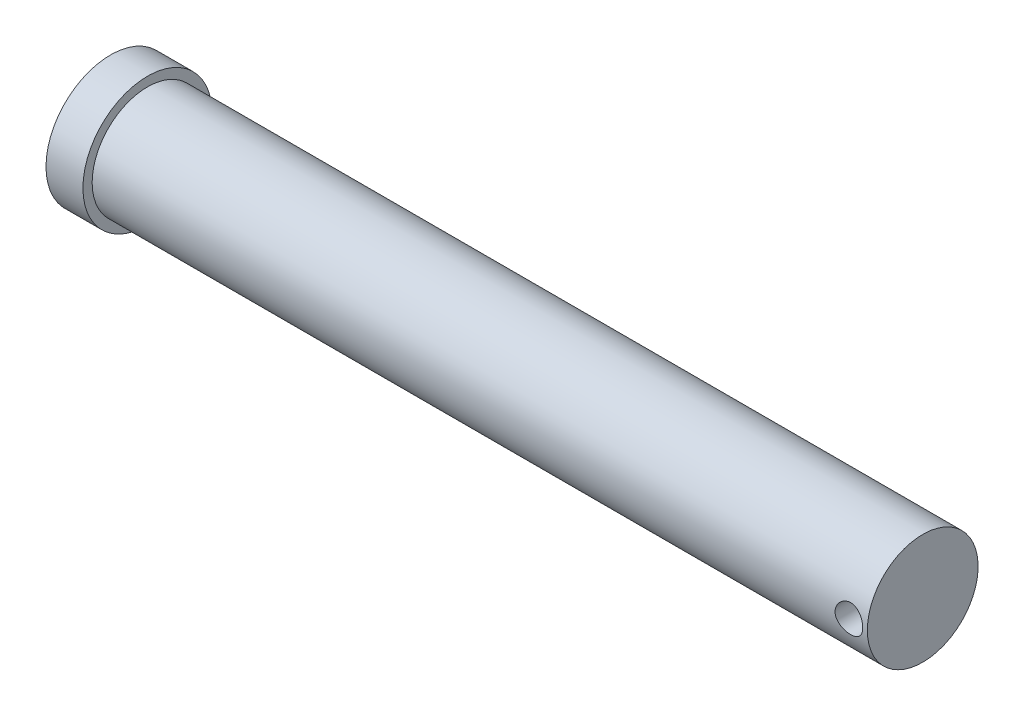
from build123d import *

# Parameters (mm, degrees)
IZIM2_R               = 7.5
KES_EKSTR_ZYON1_DEPTH = 30


with BuildPart() as part:
    # Çizim1 → Döndür1 (revolve)
    with BuildSketch(Plane.XY, mode=Mode.PRIVATE) as d_nd_r1_sk:
        Polygon((0, 0), (0, 35), (20, 35), (20, 30), (440, 30), (440, 0), align=None)
    revolve(d_nd_r1_sk.sketch.rotate(Axis((0, 0, 0), (1, 0, 0)), 90), axis=Axis((0, 0, 0), (1, 0, 0)))

    # Çizim2 → Kes-Ekstrüzyon1 (cut, symmetric)
    with BuildSketch(Plane.XY):
        with Locations((430, 0)):
            Circle(IZIM2_R)
    extrude(amount=KES_EKSTR_ZYON1_DEPTH, both=True, mode=Mode.SUBTRACT)


solid = part.part
